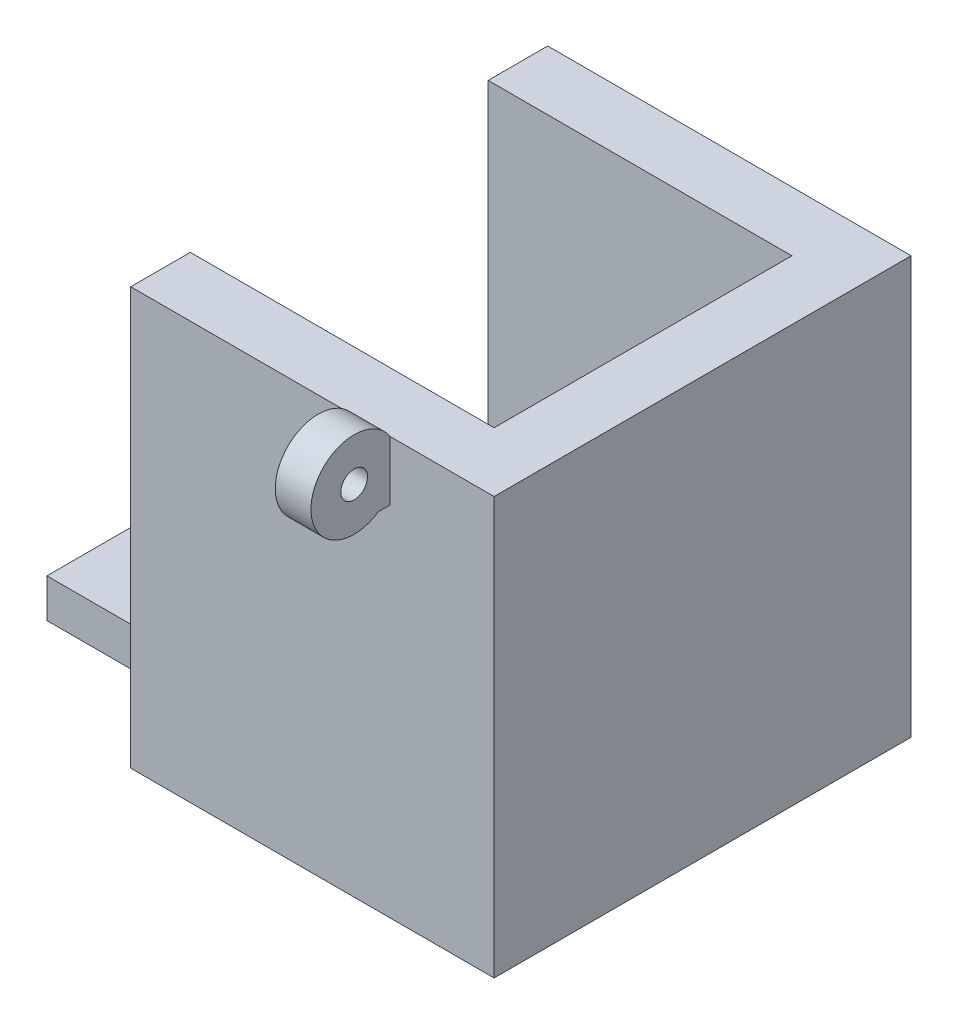
from build123d import *

# Parameters (mm, degrees)
SKETCH_1_W          = 272
SKETCH_1_H          = 140
EXTRUDE_1_DEPTH     = 140
SKETCH_2_W          = 252
SKETCH_2_H          = 100
CUT_EXTRUDE_1_DEPTH = 110
SKETCH_8_W          = 12
SKETCH_8_H          = 12
EXTRUDE_2_DEPTH     = 10
SKETCH_9_R          = 14.49
SKETCH_9_R_2        = 4.49
EXTRUDE_1_2_DEPTH   = 12
SKETCH_11_R         = 4.49
CUT_EXTRUDE_5_DEPTH = 298.354040116
SKETCH_13_W         = 150
SKETCH_13_H         = 140
CUT_EXTRUDE_7_DEPTH = 239.346904019
SKETCH_14_W         = 98.139384751
SKETCH_14_H         = 13
EXTRUDE_3_DEPTH     = 50
SKETCH_15_R         = 3
CUT_EXTRUDE_8_DEPTH = 231.670688982


with BuildPart() as part:
    # 草圖1 → Extrude 1 (new body)
    with BuildSketch(Plane(origin=(0, 0, 0), x_dir=(1, 0, 0), z_dir=(0, 1, 0))):
        with Locations((26.536585366, -7.390243902)):
            Rectangle(SKETCH_1_W, SKETCH_1_H)
    extrude(amount=EXTRUDE_1_DEPTH)

    # 草圖2 → 除料-伸長1 (cut)
    with BuildSketch(Plane(origin=(0, 140, 0), x_dir=(1, 0, 0), z_dir=(0, 1, 0))):
        with Locations((16.536585366, -7.390243902)):
            Rectangle(SKETCH_2_W, SKETCH_2_H)
    extrude(amount=-CUT_EXTRUDE_1_DEPTH, mode=Mode.SUBTRACT)

    # 草圖8 → 填料-伸長2 (add)
    with BuildSketch(Plane.XY.offset(77.390243902)):
        with Locations((121.536585366, 126)):
            Rectangle(SKETCH_8_W, SKETCH_8_H)
    extrude(amount=EXTRUDE_2_DEPTH)

    # 草圖9 → Extrude 1 2 (add)
    with BuildSketch(Plane(origin=(127.536585366, 0, 0), x_dir=(0, 0, -1), z_dir=(1, 0, 0))):
        with Locations((-89.390243902, 132)):
            Circle(SKETCH_9_R)
        with Locations((-89.390243902, 132)):
            Circle(SKETCH_9_R_2, mode=Mode.SUBTRACT)
    extrude(amount=-EXTRUDE_1_2_DEPTH)

    # 草圖11 → 除料-伸長5 (cut, through all)
    with BuildSketch(Plane(origin=(127.536585366, 0, 0), x_dir=(0, 0, -1), z_dir=(1, 0, 0))):
        with Locations((-89.390243902, 132)):
            Circle(SKETCH_11_R)
    extrude(amount=-CUT_EXTRUDE_5_DEPTH, mode=Mode.SUBTRACT)

    # 草圖13 → 除料-伸長7 (cut, through all)
    with BuildSketch(Plane(origin=(0, 140, 0), x_dir=(1, 0, 0), z_dir=(0, 1, 0))):
        with Locations((-34.463414634, -7.390243902)):
            Rectangle(SKETCH_13_W, SKETCH_13_H)
    extrude(amount=-CUT_EXTRUDE_7_DEPTH, mode=Mode.SUBTRACT)

    # 草圖14 → 填料-伸長3 (add)
    with BuildSketch(Plane.ZY.offset(-40.536585366)):
        with Locations((6.459936277, 13.5)):
            Rectangle(SKETCH_14_W, SKETCH_14_H)
    extrude(amount=EXTRUDE_3_DEPTH)

    # 草圖15 → 除料-伸長8 (cut, through all)
    with BuildSketch(Plane(origin=(0, 20, 0), x_dir=(1, 0, 0), z_dir=(0, 1, 0))):
        with Locations(Location((10.536585366, -7.390243902, 0), (0, 0, 270))):
            Circle(SKETCH_15_R)
    extrude(amount=-CUT_EXTRUDE_8_DEPTH, mode=Mode.SUBTRACT)


solid = part.part
